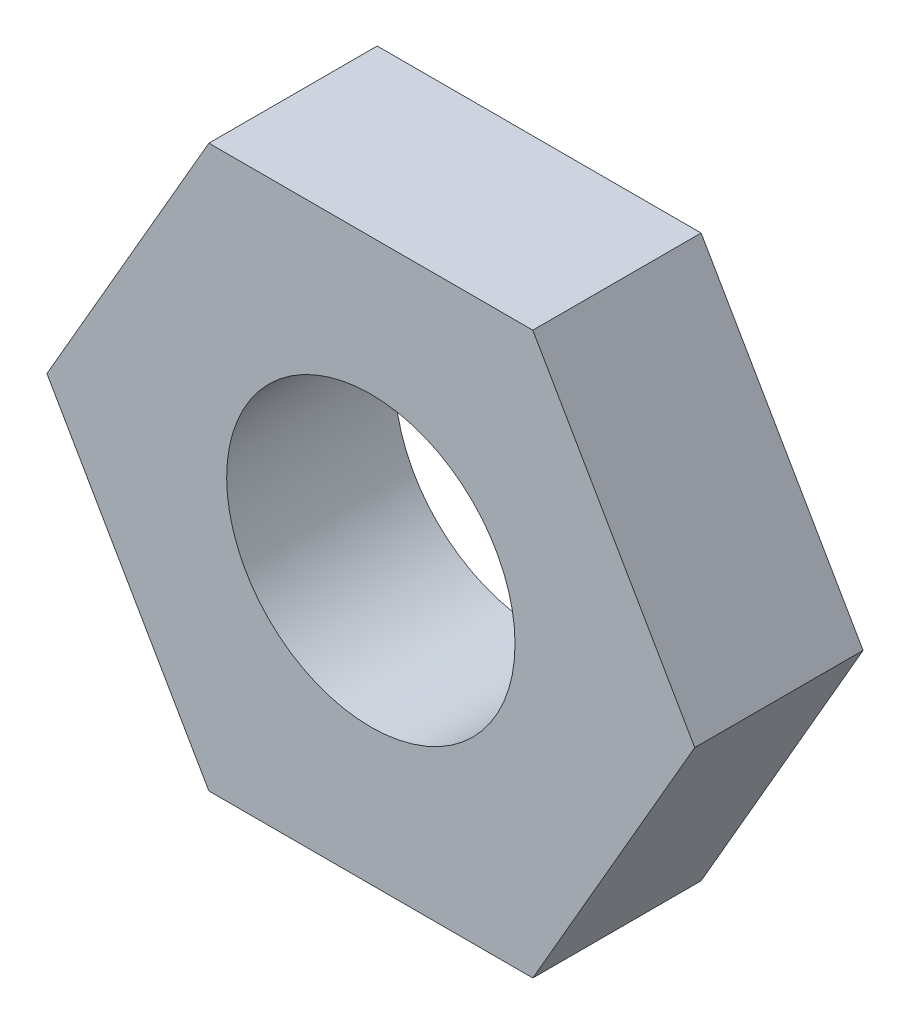
from build123d import *

# Parameters (mm, degrees)
BOSS_EXTRUDE1_DEPTH              = 3.81
TAP_DRILL_FOR_5_16_18_TAP1_D     = 6.5278
TAP_DRILL_FOR_5_16_18_TAP1_DEPTH = 25.4
TAP_DRILL_FOR_5_16_18_TAP1_TIP   = 1.961148974


with BuildPart() as part:
    # Sketch1 → Boss-Extrude1 (new body)
    with BuildSketch(Plane(origin=(0, 0, 0), x_dir=(0, 1, 0), z_dir=(0, 0, 1))):
        Polygon((0, -7.332348419), (6.35, -3.666174209), (6.35, 3.666174209), (0, 7.332348419), (-6.35, 3.666174209), (-6.35, -3.666174209), align=None)
    extrude(amount=BOSS_EXTRUDE1_DEPTH)

    # Tap Drill for 5/16-18 Tap1
    with Locations(Plane.XY.offset(3.81)):
        with Locations((0, 0)):
            Hole(TAP_DRILL_FOR_5_16_18_TAP1_D / 2, depth=TAP_DRILL_FOR_5_16_18_TAP1_DEPTH)
            with Locations((0, 0, -(TAP_DRILL_FOR_5_16_18_TAP1_DEPTH + TAP_DRILL_FOR_5_16_18_TAP1_TIP / 2))):  # 118° drill point
                Cone(0, TAP_DRILL_FOR_5_16_18_TAP1_D / 2, TAP_DRILL_FOR_5_16_18_TAP1_TIP, mode=Mode.SUBTRACT)


solid = part.part
